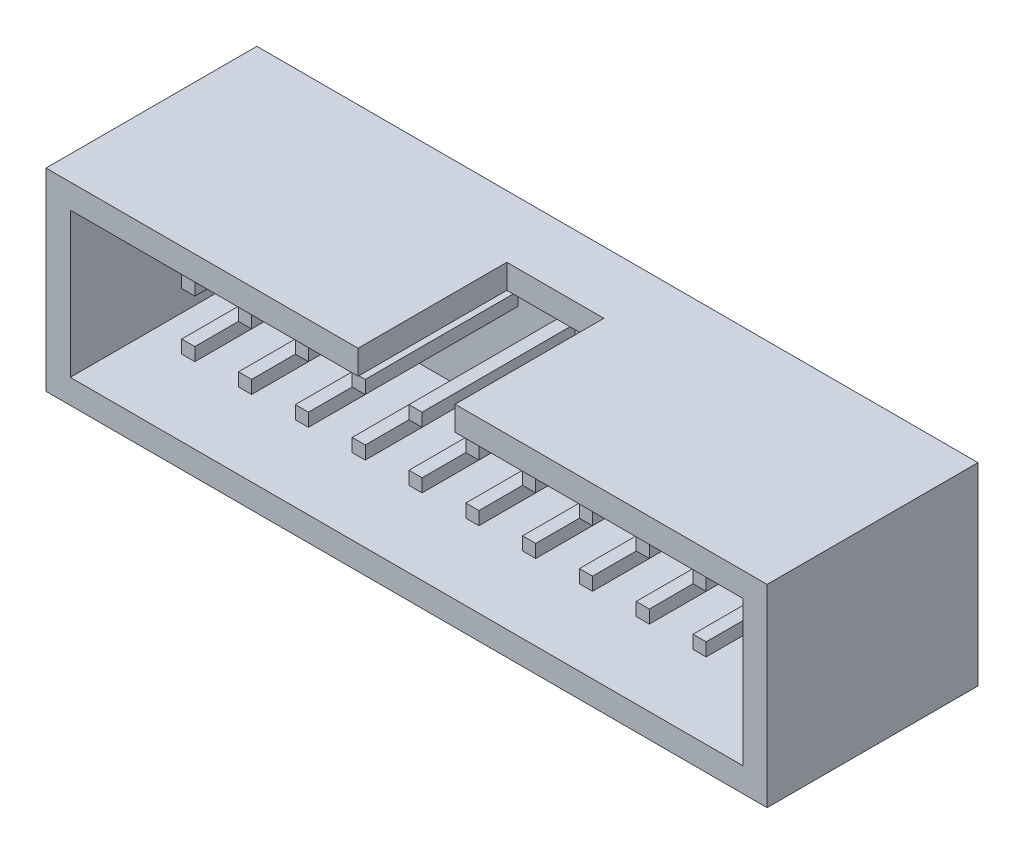
from build123d import *

# Parameters (mm, degrees)
SZKIC1_W                    = 33
SZKIC1_H                    = 8.85
DODANIE_WYCI_GNI_CIE1_DEPTH = 9.65
SKORUPA1_T                  = -1.11
WYTNIJ_WYCI_GNI_CIE1_REACH  = 23.064
SZKIC2_W                    = 4.44
SZKIC2_H                    = 6.81
SZKIC3_W                    = 0.6
SZKIC3_H                    = 0.6
DODANIE_WYCI_GNI_CIE2_DEPTH = 7


with BuildPart() as part:
    # Szkic1 → Dodanie-wyciągnięcie1 (new body)
    with BuildSketch(Plane.XY):
        Rectangle(SZKIC1_W, SZKIC1_H)
    extrude(amount=DODANIE_WYCI_GNI_CIE1_DEPTH)

    # Skorupa1
    skorupa1_openings = [part.faces().sort_by_distance(p)[0] for p in [
        (0, 0, 9.65),
    ]]
    offset(amount=SKORUPA1_T, openings=skorupa1_openings, kind=Kind.INTERSECTION)

    # Szkic2 → Wytnij-wyciągnięcie1 (cut, up to next)
    with BuildSketch(Plane(origin=(0, 4.425, 0), x_dir=(1, 0, 0), z_dir=(0, 1, 0)), mode=Mode.PRIVATE) as wytnij_wyci_gni_cie1_sk1:
        with Locations((0, -6.245)):
            Rectangle(SZKIC2_W, SZKIC2_H)
    wytnij_wyci_gni_cie1_tool1 = extrude(wytnij_wyci_gni_cie1_sk1.sketch, amount=-WYTNIJ_WYCI_GNI_CIE1_REACH, mode=Mode.PRIVATE) & part.part
    add(wytnij_wyci_gni_cie1_tool1.solids().sort_by_distance((0, 4.425, 6.245))[0], mode=Mode.SUBTRACT)

    # Szkic3 → Dodanie-wyciągnięcie2 (add)
    with BuildSketch(Plane.XY.offset(1.11)):
        with Locations((-11.53, 1.515)):
            Rectangle(SZKIC3_W, SZKIC3_H)
        with Locations((-8.93, 1.515)):
            Rectangle(SZKIC3_W, SZKIC3_H)
        with Locations((-6.33, 1.515)):
            Rectangle(SZKIC3_W, SZKIC3_H)
        with Locations((-3.73, 1.515)):
            Rectangle(SZKIC3_W, SZKIC3_H)
        with Locations((-1.13, 1.515)):
            Rectangle(SZKIC3_W, SZKIC3_H)
        with Locations((1.47, 1.515)):
            Rectangle(SZKIC3_W, SZKIC3_H)
        with Locations((4.07, 1.515)):
            Rectangle(SZKIC3_W, SZKIC3_H)
        with Locations((6.67, 1.515)):
            Rectangle(SZKIC3_W, SZKIC3_H)
        with Locations((9.27, 1.515)):
            Rectangle(SZKIC3_W, SZKIC3_H)
        with Locations((11.87, 1.515)):
            Rectangle(SZKIC3_W, SZKIC3_H)
        with Locations((-8.93, -1.085)):
            Rectangle(SZKIC3_W, SZKIC3_H)
        with Locations((-6.33, -1.085)):
            Rectangle(SZKIC3_W, SZKIC3_H)
        with Locations((-3.73, -1.085)):
            Rectangle(SZKIC3_W, SZKIC3_H)
        with Locations((-1.13, -1.085)):
            Rectangle(SZKIC3_W, SZKIC3_H)
        with Locations((1.47, -1.085)):
            Rectangle(SZKIC3_W, SZKIC3_H)
        with Locations((4.07, -1.085)):
            Rectangle(SZKIC3_W, SZKIC3_H)
        with Locations((6.67, -1.085)):
            Rectangle(SZKIC3_W, SZKIC3_H)
        with Locations((9.27, -1.085)):
            Rectangle(SZKIC3_W, SZKIC3_H)
        with Locations((11.87, -1.085)):
            Rectangle(SZKIC3_W, SZKIC3_H)
        with Locations((-11.53, -1.085)):
            Rectangle(SZKIC3_W, SZKIC3_H)
    extrude(amount=DODANIE_WYCI_GNI_CIE2_DEPTH)


solid = part.part
